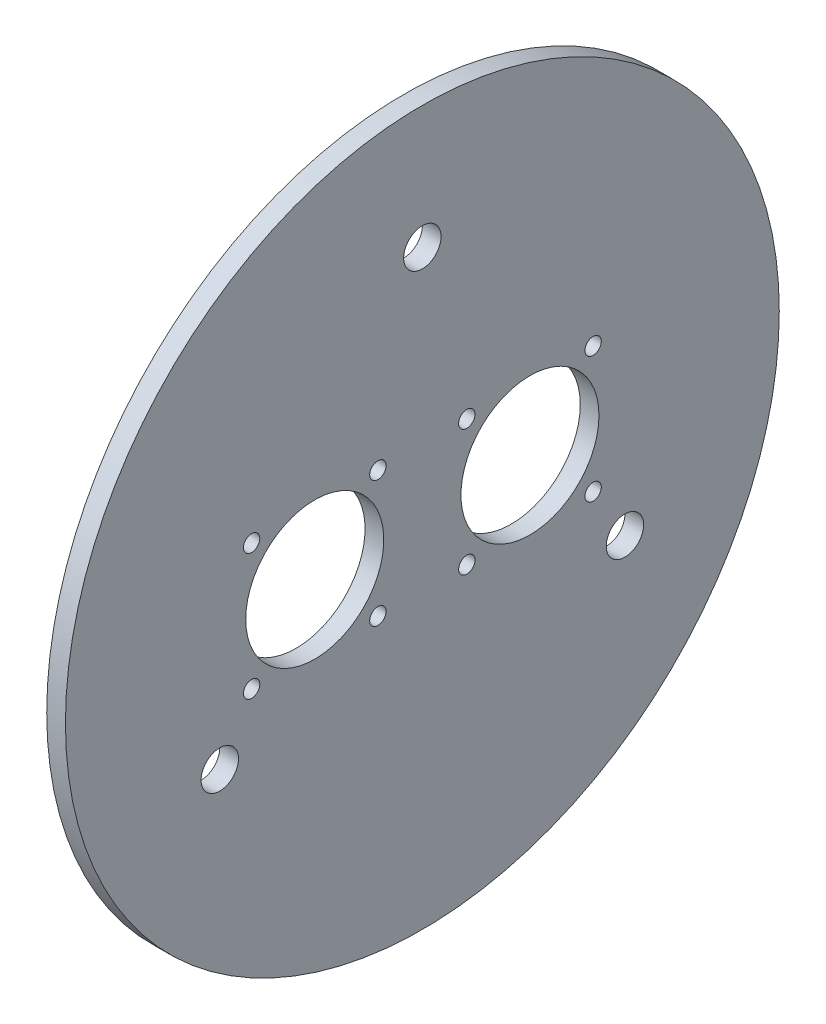
from build123d import *

# Parameters (mm, degrees)
SKETCH1_R           = 76.29
SKETCH1_R_2         = 4
SKETCH1_R_3         = 14.75
SKETCH1_R_4         = 1.75
BOSS_EXTRUDE1_DEPTH = 4


with BuildPart() as part:
    # Sketch1 → Boss-Extrude1 (new body)
    with BuildSketch(Plane(origin=(0, 0, 0), x_dir=(0, 0, -1), z_dir=(1, 0, 0))):
        Circle(SKETCH1_R)
        with Locations((0, 50)):
            Circle(SKETCH1_R_2, mode=Mode.SUBTRACT)
        with Locations((43.301270189, -25)):
            Circle(SKETCH1_R_2, mode=Mode.SUBTRACT)
        with Locations((-43.301270189, -25)):
            Circle(SKETCH1_R_2, mode=Mode.SUBTRACT)
        with Locations((23, 0)):
            Circle(SKETCH1_R_3, mode=Mode.SUBTRACT)
        with Locations(Location((-23, 0, 0), (0, 0, 180))):
            Circle(SKETCH1_R_3, mode=Mode.SUBTRACT)
        with Locations((36.496900686, 13.496900686)):
            Circle(SKETCH1_R_4, mode=Mode.SUBTRACT)
        with Locations((36.496900686, -13.496900686)):
            Circle(SKETCH1_R_4, mode=Mode.SUBTRACT)
        with Locations((9.503099314, -13.496900686)):
            Circle(SKETCH1_R_4, mode=Mode.SUBTRACT)
        with Locations((9.503099314, 13.496900686)):
            Circle(SKETCH1_R_4, mode=Mode.SUBTRACT)
        with Locations(Location((-36.496900686, -13.496900686, 0), (0, 0, 180))):
            Circle(SKETCH1_R_4, mode=Mode.SUBTRACT)
        with Locations(Location((-9.503099314, -13.496900686, 0), (0, 0, 180))):
            Circle(SKETCH1_R_4, mode=Mode.SUBTRACT)
        with Locations(Location((-9.503099314, 13.496900686, 0), (0, 0, 180))):
            Circle(SKETCH1_R_4, mode=Mode.SUBTRACT)
        with Locations(Location((-36.496900686, 13.496900686, 0), (0, 0, 180))):
            Circle(SKETCH1_R_4, mode=Mode.SUBTRACT)
    extrude(amount=BOSS_EXTRUDE1_DEPTH)


solid = part.part
